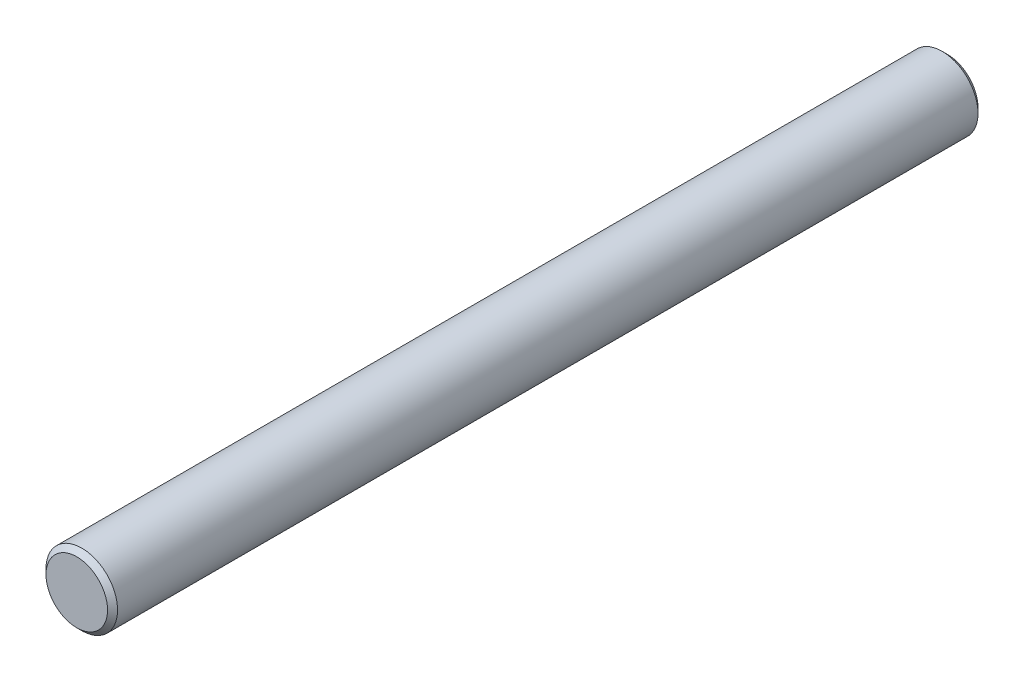
from build123d import *

# Parameters (mm, degrees)
BOSS_EXTRUDE1_DEPTH      = 48.26
BOSS_EXTRUDE1_DEPTH_BACK = 48.26
SKETCH3_R                = 3.96875
CHAMFER1_SIZE            = 0.555625


with BuildPart() as part:
    # Sketch3 → Boss-Extrude1 (new, two sides: drawn at the far end of the back side and taken through both)
    with BuildSketch(Plane.XY.offset(-BOSS_EXTRUDE1_DEPTH_BACK)):
        with Locations(Location((0, 0, 0), (0, 0, 180))):
            Circle(SKETCH3_R)
    extrude(amount=BOSS_EXTRUDE1_DEPTH + BOSS_EXTRUDE1_DEPTH_BACK)

    # Chamfer1
    chamfer1_edges = [part.edges().sort_by_distance(p)[0] for p in [
        (3.96875, 0, -48.26),
        (3.96875, 0, 48.26),
    ]]
    chamfer(chamfer1_edges, length=CHAMFER1_SIZE)


solid = part.part
